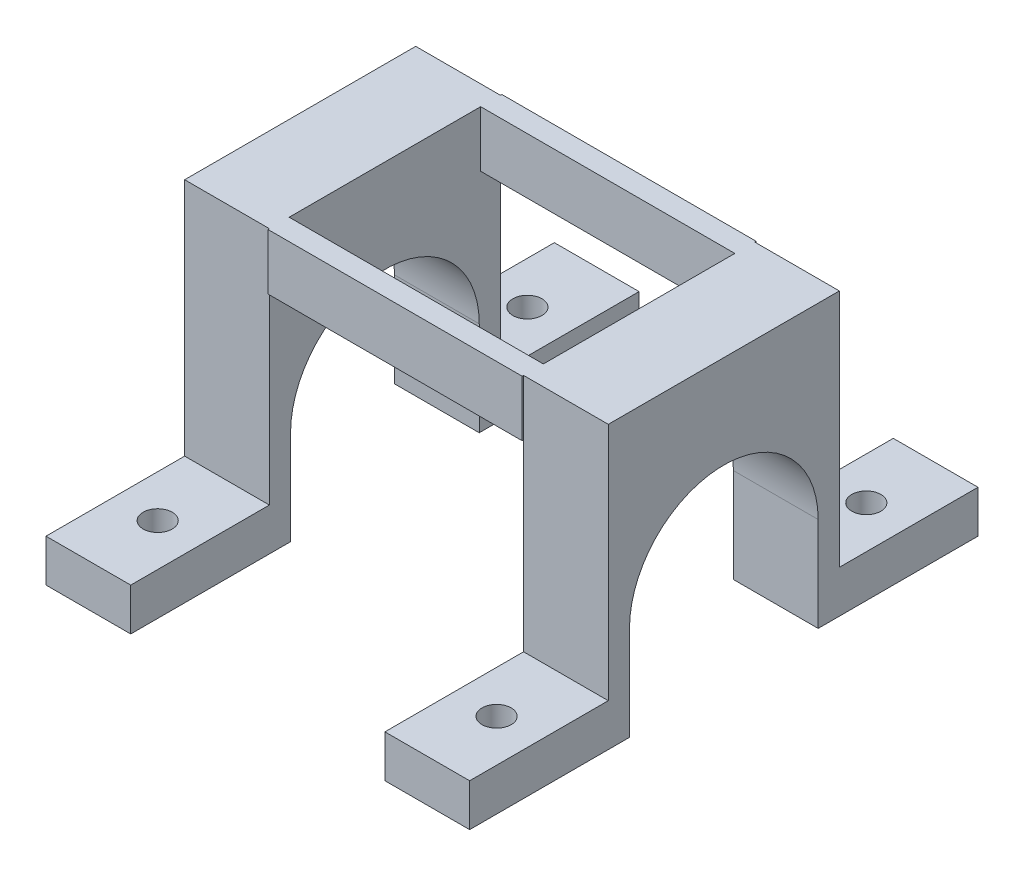
from build123d import *

# Parameters (mm, degrees)
BOSS_EXTRUDE1_DEPTH = 12.7
BOSS_EXTRUDE2_REACH = 70.373
SKETCH4_W           = 12.7
SKETCH4_H           = 34.6329
SKETCH6_W           = 3.175
SKETCH6_H           = 8.382
BOSS_EXTRUDE3_DEPTH = 19.05
SKETCH7_R           = 2.1828125
CUT_EXTRUDE1_DEPTH  = 12.7


with BuildPart() as part:
    # Sketch1 → Boss-Extrude1 (new body)
    with BuildSketch(Plane(origin=(0, 0, 0), x_dir=(0, 0, -1), z_dir=(1, 0, 0))):
        with BuildLine():
            Line((28.295148135, 2.354226963), (52.253698135, 2.354226963))
            Line((52.253698135, 2.354226963), (52.253698135, 8.704226963))
            Line((52.253698135, 8.704226963), (31.470148135, 8.704226963))
            Line((31.470148135, 8.704226963), (31.470148135, 16.495676963))
            ThreePointArc((31.470148135, 16.495676963), (14.153698135, 33.812126963), (-3.162751865, 16.495676963))
            Line((-3.162751865, 16.495676963), (-3.162751865, 8.704226963))
            Line((-3.162751865, 8.704226963), (-23.946301865, 8.704226963))
            Line((-23.946301865, 8.704226963), (-23.946301865, 2.354226963))
            Line((-23.946301865, 2.354226963), (0.012248135, 2.354226963))
            Line((0.012248135, 2.354226963), (0.012248135, 16.495676963))
            ThreePointArc((0.012248135, 16.495676963), (14.153698135, 30.637126963), (28.295148135, 16.495676963))
            Line((28.295148135, 16.495676963), (28.295148135, 2.354226963))
        make_face()
    extrude(amount=BOSS_EXTRUDE1_DEPTH)

    # Sketch4 → Boss-Extrude2 (add, up to next)
    with BuildSketch(Plane(origin=(0, 44.581726963, 0), x_dir=(1, 0, 0), z_dir=(0, 1, 0)), mode=Mode.PRIVATE) as boss_extrude2_sk1:
        with Locations((6.35, 14.153698135)):
            Rectangle(SKETCH4_W, SKETCH4_H)
    boss_extrude2_tool1 = extrude(boss_extrude2_sk1.sketch, amount=-BOSS_EXTRUDE2_REACH, mode=Mode.PRIVATE) - part.part
    add(boss_extrude2_tool1.solids().sort_by_distance((6.35, 44.581727, -14.153698))[0])

    # Sketch6 → Boss-Extrude3 (add)
    with BuildSketch(Plane(origin=(12.7, 0, 0), x_dir=(0, 0, -1), z_dir=(1, 0, 0))):
        with Locations((-1.784801865, 40.390726963)):
            Rectangle(SKETCH6_W, SKETCH6_H)
        with Locations((30.092198135, 40.390726963)):
            Rectangle(SKETCH6_W, SKETCH6_H)
    extrude(amount=BOSS_EXTRUDE3_DEPTH)

    # Sketch7 → Cut-Extrude1 (cut)
    with BuildSketch(Plane(origin=(0, 8.704226963, 0), x_dir=(1, 0, 0), z_dir=(0, 1, 0))):
        with Locations(Location((6.35, 41.861923135, 0), (0, 0, 270))):
            Circle(SKETCH7_R)
        with Locations(Location((6.35, -13.554526865, 0), (0, 0, 270))):
            Circle(SKETCH7_R)
    extrude(amount=-CUT_EXTRUDE1_DEPTH, mode=Mode.SUBTRACT)

    # Mirror1: part across plane


with BuildPart() as part_1:
    add(part.part)
    add(part.part.mirror(Plane(origin=(31.75, 0, 0), x_dir=(0, 0, 1), z_dir=(1, 0, 0))))


solid = part_1.part
